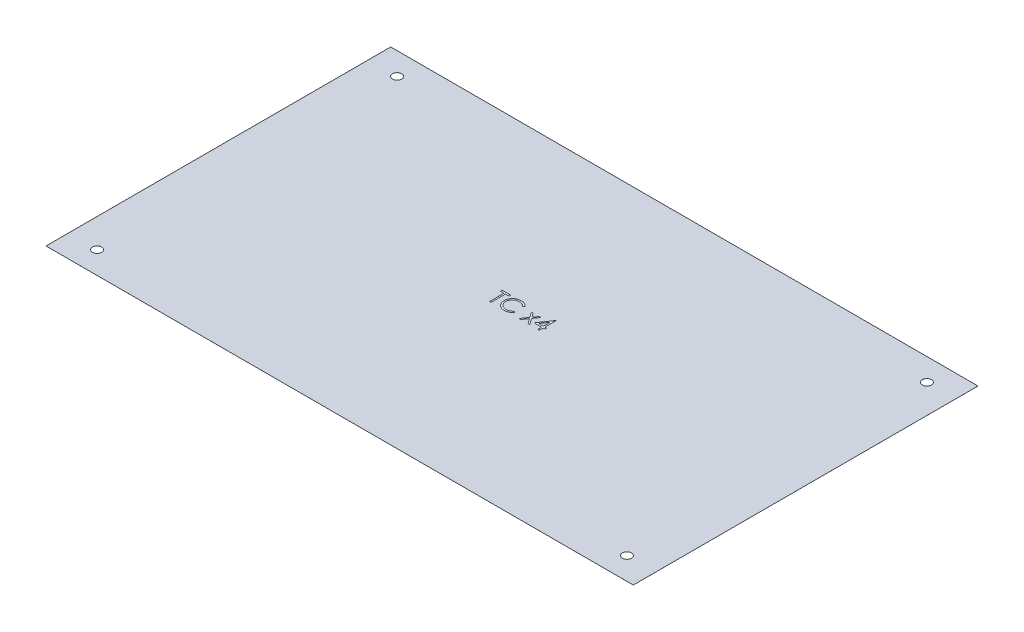
from build123d import *

# Parameters (mm, degrees)
SKETCH2_W           = 233.68
SKETCH2_H           = 137.16
BOSS_EXTRUDE1_DEPTH = 0.00254
SKETCH3_R           = 1.8288
CUT_EXTRUDE1_DEPTH  = 136.479895211
CUT_EXTRUDE2_DEPTH  = 2.54


with BuildPart() as part:
    # Sketch2 → Boss-Extrude1 (new body)
    with BuildSketch(Plane(origin=(0, 0, 0), x_dir=(1, 0, 0), z_dir=(0, 1, 0))):
        Rectangle(SKETCH2_W, SKETCH2_H)
    extrude(amount=BOSS_EXTRUDE1_DEPTH)

    # Sketch3 → Cut-Extrude1 (cut, through all)
    with BuildSketch(Plane(origin=(0, 0.00254, 0), x_dir=(1, 0, 0), z_dir=(0, 1, 0))):
        with Locations(Location((-105.41, 59.69, 0), (0, 0, 270))):
            Circle(SKETCH3_R)
        with Locations(Location((105.41, 59.69, 0), (0, 0, 270))):
            Circle(SKETCH3_R)
        with Locations(Location((105.41, -59.69, 0), (0, 0, 270))):
            Circle(SKETCH3_R)
        with Locations(Location((-105.41, -59.69, 0), (0, 0, 270))):
            Circle(SKETCH3_R)
    extrude(amount=-CUT_EXTRUDE1_DEPTH, mode=Mode.SUBTRACT)

    # Sketch5 → Cut-Extrude2 (cut)
    # profile 1 of 4: a face of its own
    with BuildSketch(Plane(origin=(0, 0.00254, 0), x_dir=(1, 0, 0), z_dir=(0, 1, 0))):
        Polygon((-10.824558334, 6.268971897), (-10.824558334, 6.920253948), (-7.486737822, 6.920253948), (-7.486737822, 6.268971897), (-8.870712181, 6.268971897), (-8.870712181, 0.570253948), (-9.440583975, 0.570253948), (-9.440583975, 6.268971897), align=None)
    # profile 2 of 4: a face of its own
    with BuildSketch(Plane(origin=(0, 0.00254, 0), x_dir=(1, 0, 0), z_dir=(0, 1, 0))):
        with BuildLine():
            Line((-0.648276283, 5.755069653), (-1.146914104, 5.373459076))
            add(Edge.make_bspline(
                [(-1.146914104, 5.373459076), (-1.182484787, 5.415851622), (-1.253146583, 5.500065169), (-1.366828279, 5.618319485), (-1.485304117, 5.729109317), (-1.608528808, 5.832962441), (-1.738720354, 5.926247145), (-1.872724946, 6.013824717), (-2.012784256, 6.092324756), (-2.206462403, 6.187507602), (-2.4598235, 6.286832769), (-2.778765565, 6.370114346), (-3.111707129, 6.423129907), (-3.338851346, 6.428871834), (-3.454386059, 6.43179241)],
                knots=[0, 0, 0, 0, 0.757959112, 1.505699292, 2.245454638, 2.979532153, 3.711538275, 4.438200793, 5.171680507, 5.909471876, 7.393775596, 8.890124382, 10.418191784, 12, 12, 12, 12], degree=3))
            add(Edge.make_bspline(
                [(-3.454386059, 6.43179241), (-3.518037188, 6.431059506), (-3.644748703, 6.429600501), (-3.832796647, 6.410352517), (-4.017333183, 6.383299322), (-4.198238272, 6.343157664), (-4.375281639, 6.292407341), (-4.549620712, 6.23176409), (-4.718731371, 6.156734595), (-4.884953032, 6.073806752), (-5.044209601, 5.980139816), (-5.194895187, 5.877971306), (-5.336460215, 5.768444517), (-5.469016668, 5.651148938), (-5.59270006, 5.52661281), (-5.706614181, 5.393508933), (-5.810364854, 5.252262847), (-5.9060086, 5.104737093), (-5.991665987, 4.951361385), (-6.063384483, 4.791568043), (-6.126893776, 4.628093456), (-6.177148116, 4.459090636), (-6.216925454, 4.285748761), (-6.244371357, 4.107602617), (-6.263400441, 3.92502437), (-6.26485219, 3.801273188), (-6.265583975, 3.738893772)],
                knots=[0, 0, 0, 0, 1.054917814, 2.100044995, 3.131103042, 4.146048494, 5.169673617, 6.183595914, 7.203665975, 8.234915748, 9.262203917, 10.264457458, 11.251630812, 12.227803204, 13.197192746, 14.159520551, 15.12972552, 16.100847026, 17.073214652, 18.039054194, 19.002613845, 19.979014051, 20.95965708, 21.949030935, 22.966165397, 24, 24, 24, 24], degree=3))
            add(Edge.make_bspline(
                [(-6.265583975, 3.738893772), (-6.263294675, 3.645038377), (-6.258799938, 3.460765759), (-6.21879796, 3.190853366), (-6.158010152, 2.932280143), (-6.066904748, 2.686662429), (-5.954565899, 2.450971551), (-5.812615075, 2.229195346), (-5.648210786, 2.017982436), (-5.459027197, 1.822324516), (-5.251462359, 1.643592472), (-5.028762577, 1.486202131), (-4.791482512, 1.355002273), (-4.542242054, 1.245825913), (-4.279123247, 1.161902992), (-4.002599249, 1.102822368), (-3.713271486, 1.064282984), (-3.51556986, 1.060593292), (-3.414952966, 1.058715487)],
                knots=[0, 0, 0, 0, 1.029171465, 2.020641659, 2.987623507, 3.938342917, 4.889210282, 5.84687017, 6.821220943, 7.821438502, 8.827599549, 9.822697543, 10.807740252, 11.797342354, 12.80366471, 13.83203677, 14.896651826, 16, 16, 16, 16], degree=3))
            add(Edge.make_bspline(
                [(-3.414952966, 1.058715487), (-3.30409523, 1.061779416), (-3.085900687, 1.067809961), (-2.765918696, 1.118898884), (-2.459602379, 1.201735392), (-2.166935257, 1.31766448), (-1.888742399, 1.468368645), (-1.624588458, 1.651063366), (-1.374250466, 1.867486484), (-1.223716854, 2.032737302), (-1.146914104, 2.11704882)],
                knots=[0, 0, 0, 0, 1.028121516, 2.023589091, 2.998037872, 3.967518031, 4.937445131, 5.927275754, 6.942489185, 8, 8, 8, 8], degree=3))
            Line((-1.146914104, 2.11704882), (-0.648276283, 1.739254349))
            add(Edge.make_bspline(
                [(-0.648276283, 1.739254349), (-0.688404854, 1.687477443), (-0.768469782, 1.58417164), (-0.898115041, 1.438535824), (-1.034689567, 1.301549931), (-1.179207783, 1.17431839), (-1.330007205, 1.054295288), (-1.489795543, 0.944890537), (-1.656472217, 0.844577075), (-1.829472485, 0.752725369), (-2.00861254, 0.67123265), (-2.193677729, 0.601466528), (-2.383870345, 0.541368514), (-2.579199081, 0.491925715), (-2.780069097, 0.453333891), (-2.985755529, 0.427535338), (-3.196702303, 0.409860722), (-3.339017452, 0.408249789), (-3.41113686, 0.407433435)],
                knots=[0, 0, 0, 0, 0.986787822, 1.968848986, 2.935600012, 3.899624008, 4.868462664, 5.837806735, 6.815139263, 7.798259679, 8.787526145, 9.778297419, 10.776456485, 11.791383307, 12.812564526, 13.85620153, 14.913611965, 16, 16, 16, 16], degree=3))
            add(Edge.make_bspline(
                [(-3.41113686, 0.407433435), (-3.479433227, 0.407908765), (-3.614480837, 0.40884867), (-3.813868572, 0.424074459), (-4.00797824, 0.444847553), (-4.196255061, 0.476126077), (-4.379726473, 0.513036522), (-4.556729248, 0.562514373), (-4.729005129, 0.61793929), (-4.895861976, 0.683081195), (-5.057441717, 0.756589126), (-5.213223203, 0.839668097), (-5.363134788, 0.93161948), (-5.508650337, 1.030416427), (-5.647620239, 1.139232389), (-5.781248778, 1.256556141), (-5.91028527, 1.381992246), (-5.990118713, 1.472443194), (-6.030257453, 1.517920214)],
                knots=[0, 0, 0, 0, 1.114604814, 2.203992996, 3.262667896, 4.300477797, 5.318619304, 6.316056647, 7.298880507, 8.271930387, 9.238335007, 10.195173496, 11.151986948, 12.108099108, 13.064862484, 14.031167946, 15.010108607, 16, 16, 16, 16], degree=3))
            add(Edge.make_bspline(
                [(-6.030257453, 1.517920214), (-6.094547835, 1.596916371), (-6.222352428, 1.753954974), (-6.385866169, 2.008473826), (-6.525833876, 2.274209005), (-6.639001618, 2.55255659), (-6.727471148, 2.842891993), (-6.788759888, 3.145361569), (-6.82858637, 3.459682835), (-6.833140751, 3.673472438), (-6.83545577, 3.782142971)],
                knots=[0, 0, 0, 0, 0.994628077, 1.977248131, 2.950237994, 3.925870899, 4.908910175, 5.911660606, 6.938484602, 8, 8, 8, 8], degree=3))
            add(Edge.make_bspline(
                [(-6.83545577, 3.782142971), (-6.832634205, 3.896362151), (-6.827082951, 4.121081257), (-6.779919151, 4.450871143), (-6.704047906, 4.766831538), (-6.59628498, 5.068372618), (-6.459659557, 5.357080412), (-6.2908827, 5.630749455), (-6.091915171, 5.891129934), (-5.864317441, 6.134270983), (-5.614730989, 6.35659238), (-5.34745257, 6.552183635), (-5.063005323, 6.714956843), (-4.764522935, 6.851021309), (-4.449770342, 6.955604835), (-4.119419086, 7.028817045), (-3.774089912, 7.074386671), (-3.538482369, 7.080147405), (-3.418769072, 7.083074461)],
                knots=[0, 0, 0, 0, 1.032925535, 2.032216505, 3.007276963, 3.968222605, 4.92396291, 5.891752235, 6.871517503, 7.883894988, 8.900124299, 9.891468569, 10.874487609, 11.85992873, 12.854644235, 13.869047385, 14.917252991, 16, 16, 16, 16], degree=3))
            add(Edge.make_bspline(
                [(-3.418769072, 7.083074461), (-3.34580853, 7.082199725), (-3.201390485, 7.080468272), (-2.987753529, 7.063584271), (-2.779759593, 7.035438157), (-2.577265383, 6.997127573), (-2.37928578, 6.949580004), (-2.187333914, 6.887639749), (-2.000283439, 6.816816328), (-1.819314049, 6.735248825), (-1.645294022, 6.643687737), (-1.478277558, 6.543147963), (-1.319591315, 6.433754144), (-1.16811869, 6.316436669), (-1.026393564, 6.188713569), (-0.890392024, 6.05409793), (-0.76473264, 5.908712278), (-0.687166129, 5.806377612), (-0.648276283, 5.755069653)],
                knots=[0, 0, 0, 0, 1.096760587, 2.17092713, 3.219439832, 4.250915756, 5.268269357, 6.278326846, 7.281116186, 8.274029601, 9.260640565, 10.235837813, 11.203064059, 12.156899882, 13.114053108, 14.069676657, 15.032185724, 16, 16, 16, 16], degree=3))
        make_face()
    # profile 3 of 4: a face of its own
    with BuildSketch(Plane(origin=(0, 0.00254, 0), x_dir=(1, 0, 0), z_dir=(0, 1, 0))):
        Polygon((2.526723717, 5.210638564), (3.204718508, 5.210638564), (4.399159614, 3.536640166), (5.59360072, 5.210638564), (6.271595512, 5.210638564), (4.738793028, 3.062171015), (6.515826281, 0.570253948), (5.837831489, 0.570253948), (4.399159614, 2.58642983), (2.960487739, 0.570253948), (2.282492948, 0.570253948), (4.060798236, 3.062171015), align=None)
    # profile 4 of 4: a face of its own
    with BuildSketch(Plane(origin=(0, 0.00254, 0), x_dir=(1, 0, 0), z_dir=(0, 1, 0))):
        Polygon((10.226353124, 7.083074461), (10.342108332, 7.083074461), (10.342108332, 2.686920615), (11.07480064, 2.686920615), (11.07480064, 2.035638564), (10.342108332, 2.035638564), (10.342108332, 0.570253948), (9.772236537, 0.570253948), (9.772236537, 2.035638564), (6.76005705, 2.035638564), align=None)
        Polygon((9.772236537, 2.686920615), (9.772236537, 5.444693051), (7.879448076, 2.686920615), align=None, mode=Mode.SUBTRACT)
    extrude(amount=-CUT_EXTRUDE2_DEPTH, mode=Mode.SUBTRACT)


with BuildPart() as cut_extrude2_piece_1:
    # of the separate pieces the step leaves, piece 1, a body of its own (cut_extrude2_pieces)
    add(part.part.solids().sort_by_distance((-116.84, 0, 68.58))[0])


with BuildPart() as cut_extrude2_piece_2:
    # of the separate pieces the step leaves, piece 2, a body of its own (cut_extrude2_pieces)
    add(part.part.solids().sort_by_distance((7.879448076, 0, -2.686920615))[0])


solid = Compound([cut_extrude2_piece_1.part, cut_extrude2_piece_2.part])
